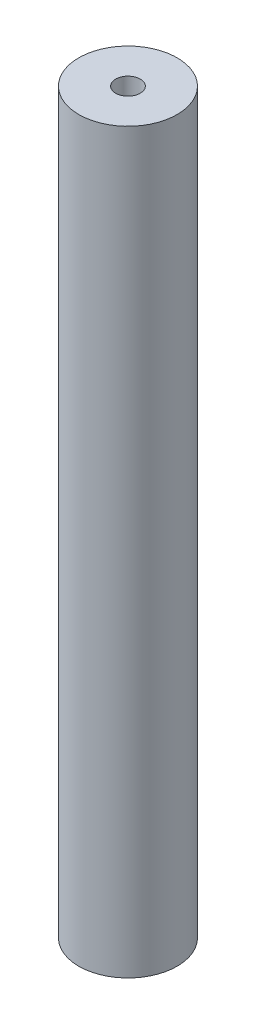
from build123d import *

# Parameters (mm, degrees)
SKETCH1_R                   = 12
EXTRUDE1_DEPTH              = 180
M6_TAPPED_HOLE1_D           = 5
M6_TAPPED_HOLE1_DEPTH       = 15
M6_TAPPED_HOLE1_CBORE_D     = 6
M6_TAPPED_HOLE1_CBORE_DEPTH = 12
M6_TAPPED_HOLE1_TIP         = 1.502151548


with BuildPart() as part:
    # Sketch1 → Extrude1 (new body)
    with BuildSketch(Plane(origin=(0, 0, 0), x_dir=(1, 0, 0), z_dir=(0, 1, 0))):
        with Locations(Location((0, 0, 0), (0, 0, 270))):
            Circle(SKETCH1_R)
    extrude(amount=-EXTRUDE1_DEPTH)

    # M6 Tapped Hole1
    with Locations(Plane(origin=(0, 0, 0), x_dir=(-1, 0, 0), z_dir=(0, 1, 0))):
        with Locations((0, 0)):
            CounterBoreHole(M6_TAPPED_HOLE1_D / 2, M6_TAPPED_HOLE1_CBORE_D / 2, M6_TAPPED_HOLE1_CBORE_DEPTH, depth=M6_TAPPED_HOLE1_DEPTH)
            with Locations((0, 0, -(M6_TAPPED_HOLE1_DEPTH + M6_TAPPED_HOLE1_TIP / 2))):  # 118° drill point
                Cone(0, M6_TAPPED_HOLE1_D / 2, M6_TAPPED_HOLE1_TIP, mode=Mode.SUBTRACT)


solid = part.part
